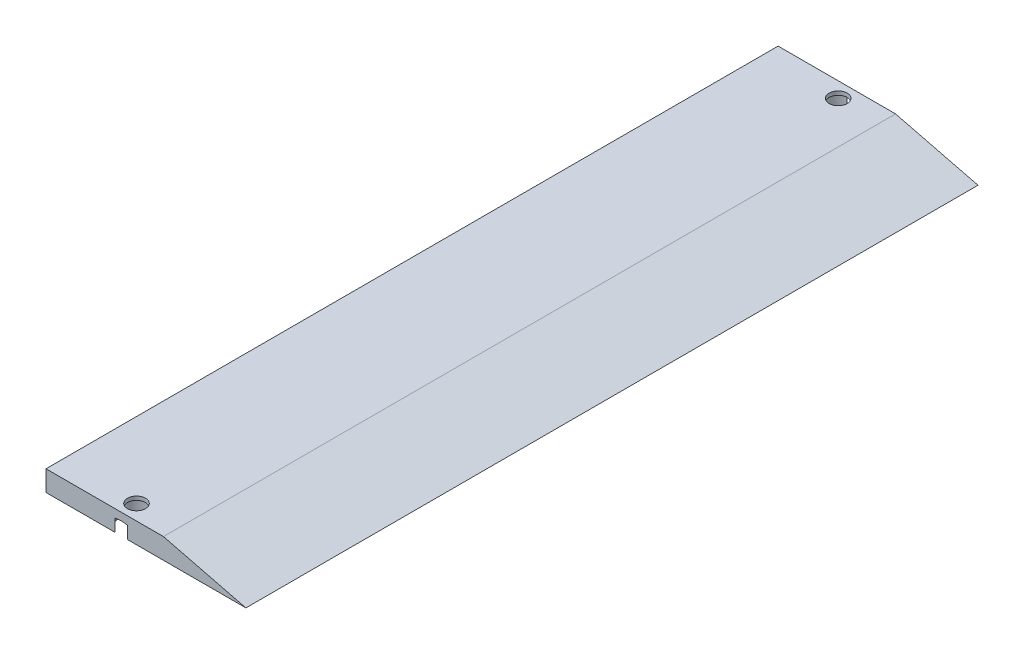
from build123d import *

# Parameters (mm, degrees)
BOSS_EXTRUDE1_DEPTH = 44.5
HOLEWZD2_AT_2_COUNT = 2
HOLEWZD2_AT_2_PITCH = 85.3


with BuildPart() as part:
    # Sketch1 → Boss-Extrude1 (new, symmetric)
    with BuildSketch(Plane.XY):
        Polygon((0, 0), (0, 2.5), (14.273047666, 2.5), (24.3, 0), align=None)
    extrude(amount=BOSS_EXTRUDE1_DEPTH, both=True)

    # Sketch6 → HoleWzd2 (revolve, cut)
    with BuildSketch(Plane(origin=(9.15, 0, 42.65), x_dir=(0, 0, -1), z_dir=(1, 0, 0))):
        Polygon((0, 0), (0, 2.5), (1.1, 2.5), (1.1, 2.040774557), (2, 1.5), (2, 0), align=None)
    holewzd2 = revolve(axis=Axis((9.15, -6.130023899, 42.65), (0, 1, 0)), mode=Mode.SUBTRACT)

    # HoleWzd2 at 2: HoleWzd2 ×2
    with Locations(*[(0, 0, -i * HOLEWZD2_AT_2_PITCH) for i in range(1, HOLEWZD2_AT_2_COUNT)]):
        add(holewzd2, mode=Mode.SUBTRACT)


solid = part.part
